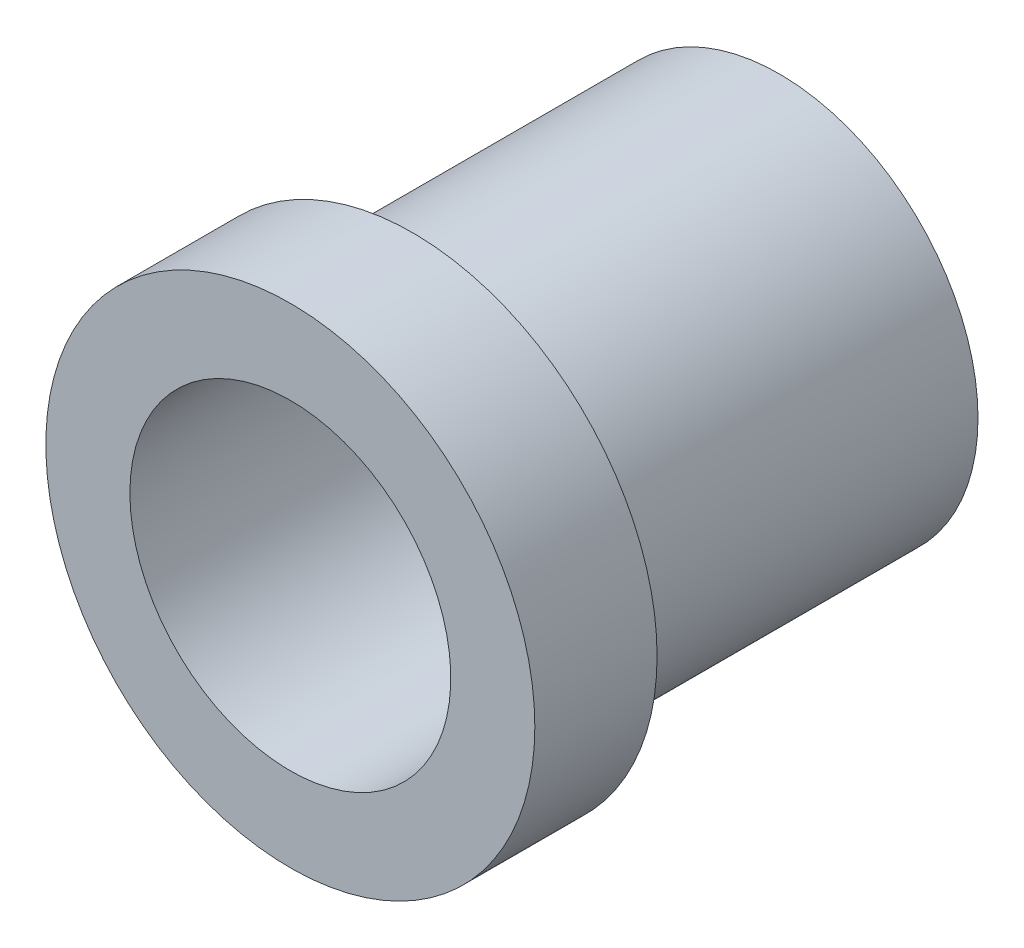
from build123d import *

# Parameters (mm, degrees)
SKETCH1_R           = 6.5
BOSS_EXTRUDE1_DEPTH = 12
SKETCH2_R           = 5.25
CUT_EXTRUDE1_DEPTH  = 14
SKETCH4_R           = 8
BOSS_EXTRUDE2_DEPTH = 4
SKETCH5_R           = 5.25
CUT_EXTRUDE2_DEPTH  = 17.492422502


with BuildPart() as part:
    # Sketch1 → Boss-Extrude1 (new body)
    with BuildSketch(Plane.XY):
        Circle(SKETCH1_R)
    extrude(amount=BOSS_EXTRUDE1_DEPTH)

    # Sketch2 → Cut-Extrude1 (cut)
    with BuildSketch(Plane.XY):
        Circle(SKETCH2_R)
    extrude(amount=CUT_EXTRUDE1_DEPTH, mode=Mode.SUBTRACT)

    # Sketch4 → Boss-Extrude2 (add)
    with BuildSketch(Plane.XY.offset(12)):
        Circle(SKETCH4_R)
    extrude(amount=BOSS_EXTRUDE2_DEPTH)

    # Sketch5 → Cut-Extrude2 (cut, through all)
    with BuildSketch(Plane(origin=(0, 0, 12), x_dir=(-1, 0, 0), z_dir=(0, 0, -1))):
        Circle(SKETCH5_R)
    extrude(amount=-CUT_EXTRUDE2_DEPTH, mode=Mode.SUBTRACT)


solid = part.part
